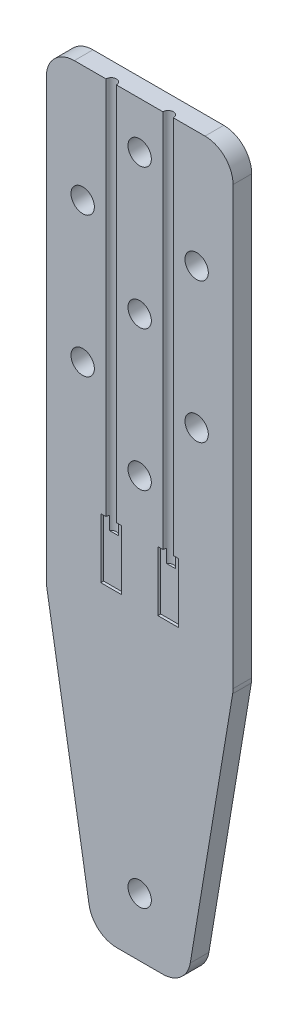
from build123d import *

# Parameters (mm, degrees)
EXTRUDE1_DEPTH     = 2.54
SKETCH2_R          = 1.5875
CUT_EXTRUDE1_DEPTH = 2.54
SKETCH3_W          = 2.794
SKETCH3_H          = 8.128
CUT_EXTRUDE2_DEPTH = 0.381
SKETCH4_R          = 0.7112
CUT_EXTRUDE3_DEPTH = 53.34
FILLET1_R          = 3.81
SKETCH5_R          = 1.5875
CUT_EXTRUDE4_DEPTH = 2.54


with BuildPart() as part:
    # Sketch1 → Extrude1 (new body)
    with BuildSketch(Plane.XY):
        Polygon((88.9, 127), (88.9, 63.5), (95.25, 25.4), (107.95, 25.4), (114.3, 63.5), (114.3, 127), align=None)
    extrude(amount=-EXTRUDE1_DEPTH)

    # Sketch2 → Cut-Extrude1 (cut)
    with BuildSketch(Plane.XY):
        with Locations((93.850000001, 111.125)):
            Circle(SKETCH2_R)
        with Locations((101.6, 120.65)):
            Circle(SKETCH2_R)
        with Locations((109.349999999, 111.125)):
            Circle(SKETCH2_R)
        with Locations((101.6, 101.6)):
            Circle(SKETCH2_R)
        with Locations((93.850000001, 92.075)):
            Circle(SKETCH2_R)
        with Locations((109.349999999, 92.075)):
            Circle(SKETCH2_R)
        with Locations((101.6, 82.55)):
            Circle(SKETCH2_R)
    extrude(amount=-CUT_EXTRUDE1_DEPTH, mode=Mode.SUBTRACT)

    # Sketch3 → Cut-Extrude2 (cut)
    with BuildSketch(Plane.XY):
        with Locations((97.725, 71.374)):
            Rectangle(SKETCH3_W, SKETCH3_H)
        with Locations((105.475, 71.374)):
            Rectangle(SKETCH3_W, SKETCH3_H)
    extrude(amount=-CUT_EXTRUDE2_DEPTH, mode=Mode.SUBTRACT)

    # Sketch4 → Cut-Extrude3 (cut)
    with BuildSketch(Plane(origin=(0, 127, 0), x_dir=(1, 0, 0), z_dir=(0, 1, 0))):
        with Locations((97.725, 0)):
            Circle(SKETCH4_R)
        with Locations((105.475, 0)):
            Circle(SKETCH4_R)
    extrude(amount=-CUT_EXTRUDE3_DEPTH, mode=Mode.SUBTRACT)

    # Fillet1
    fillet1_edges = [part.edges().sort_by_distance(p)[0] for p in [
        (95.25, 25.4, -1.27),
        (88.9, 63.5, -1.27),
        (88.9, 127, -1.27),
        (114.3, 127, -1.27),
        (114.3, 63.5, -1.27),
        (107.95, 25.4, -1.27),
    ]]
    fillet(fillet1_edges, radius=FILLET1_R)

    # Sketch5 → Cut-Extrude4 (cut)
    with BuildSketch(Plane.XY):
        with Locations((101.6, 33.3375)):
            Circle(SKETCH5_R)
    extrude(amount=-CUT_EXTRUDE4_DEPTH, mode=Mode.SUBTRACT)


solid = part.part
